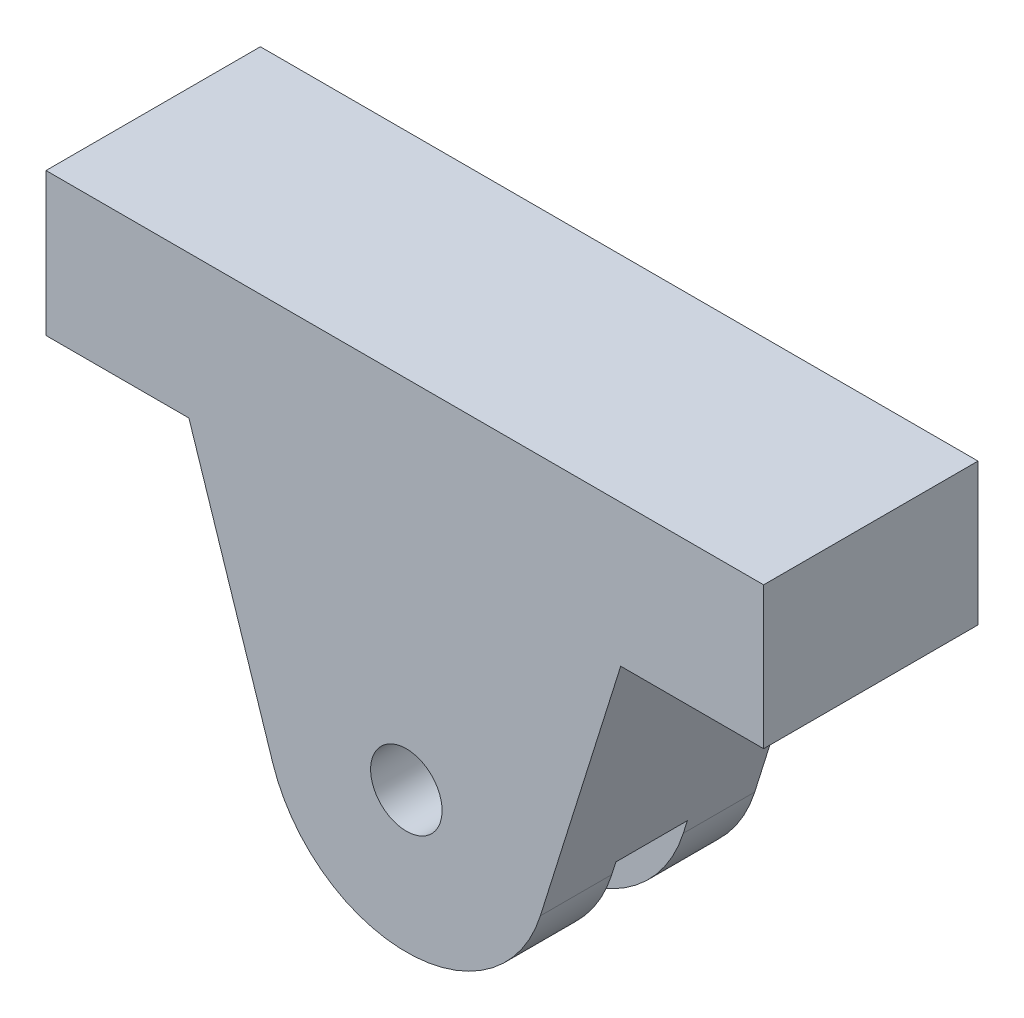
from build123d import *

# Parameters (mm, degrees)
SKETCH1_R          = 5
BASE_EXTRUDE_DEPTH = 15
CUT_EXTRUDE1_DEPTH = 5


with BuildPart() as part:
    # Sketch1 → Base-Extrude (new, symmetric)
    with BuildSketch(Plane.XY):
        with BuildLine():
            Line((30.426111358, 20.139143504), (19.180390516, -15.739203845))
            ThreePointArc((19.180390516, -15.739203845), (0.542906018, -29.514464646), (-18.256979683, -15.96168131))
            Line((-18.256979683, -15.96168131), (-30, 20))
            Line((-30, 20), (-50, 20))
            Line((-50, 20), (-50, 40))
            Line((-50, 40), (50.426111358, 40))
            Line((50.426111358, 40), (50.426111358, 20.139143504))
            Line((50.426111358, 20.139143504), (30.426111358, 20.139143504))
        make_face()
        with Locations((0.426111358, -9.860856496)):
            Circle(SKETCH1_R, mode=Mode.SUBTRACT)
    extrude(amount=BASE_EXTRUDE_DEPTH, both=True)

    # Sketch2 → Cut-Extrude1 (cut, symmetric)
    with BuildSketch(Plane.XY):
        with BuildLine():
            Line((-50.148365525, -40), (50.000039492, -40))
            Line((50.000039492, -40), (6.45662049, -2.46739488))
            ThreePointArc((6.45662049, -2.46739488), (-0.072081984, -0.041909569), (-6.600887406, -2.467117756))
            Line((-6.600887406, -2.467117756), (-50.148365525, -40))
        make_face()
    extrude(amount=CUT_EXTRUDE1_DEPTH, both=True, mode=Mode.SUBTRACT)


solid = part.part
